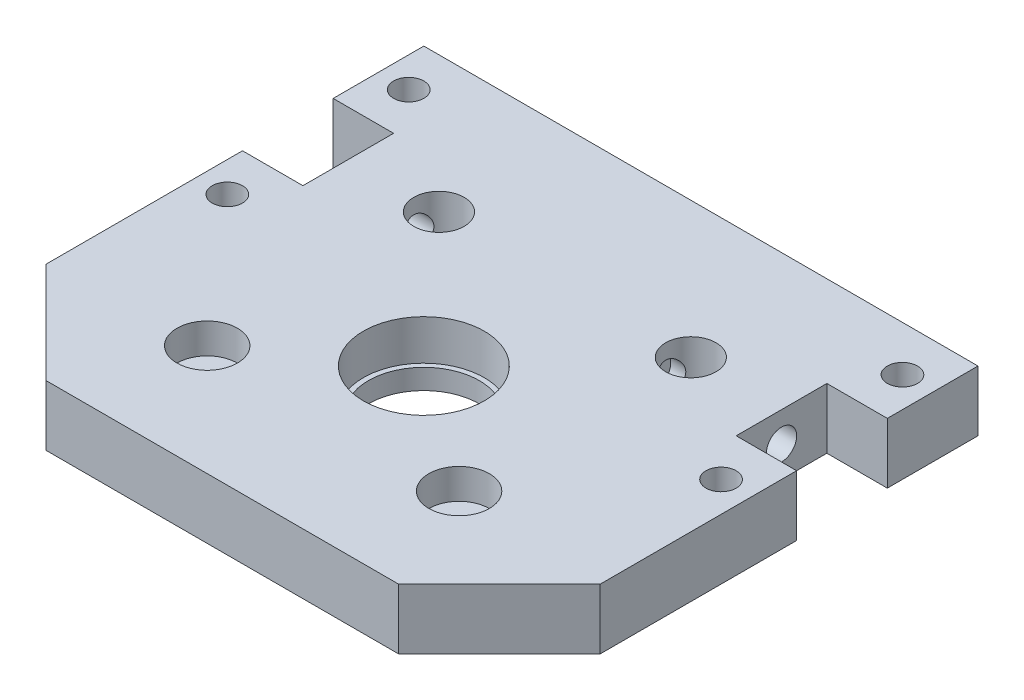
from build123d import *

# Parameters (mm, degrees)
SKETCH1_W           = 66
SKETCH1_H           = 95
SKETCH1_R           = 11
BOSS_EXTRUDE1_DEPTH = 12
BOSS_EXTRUDE3_DEPTH = 12
SKETCH4_R           = 12
CUT_EXTRUDE1_DEPTH  = 8
SKETCH6_R           = 6
CUT_EXTRUDE2_DEPTH  = 6
CHAMFER1_SIZE       = 20
CUT_EXTRUDE3_REACH  = 91.828
SKETCH7_R           = 3
SKETCH7_R_2         = 5
SKETCH9_R           = 3
CUT_EXTRUDE5_DEPTH  = 25


with BuildPart() as part:
    # Sketch1 → Boss-Extrude1 (new body)
    with BuildSketch(Plane(origin=(0, 0, 0), x_dir=(1, 0, 0), z_dir=(0, 1, 0))):
        with Locations((0, -22.5)):
            Rectangle(SKETCH1_W, SKETCH1_H)
        with Locations(Location((0, -30, 0), (0, 0, 270))):
            Circle(SKETCH1_R, mode=Mode.SUBTRACT)
    extrude(amount=BOSS_EXTRUDE1_DEPTH)

    # Sketch3 → Boss-Extrude3 (add)
    with BuildSketch(Plane(origin=(0, 12, 0), x_dir=(1, 0, 0), z_dir=(0, 1, 0))):
        Polygon((55, 7), (43, 7), (43, -11), (55, -11), (55, -70), (33, -70), (33, 25), (55, 25), align=None)
    boss_extrude3 = extrude(amount=-BOSS_EXTRUDE3_DEPTH)

    # Mirror1: Boss-Extrude3 across plane
    add(boss_extrude3.mirror(Plane(origin=(0, 0, 0), x_dir=(0, 0, 1), z_dir=(1, 0, 0))))

    # Sketch4 → Cut-Extrude1 (cut)
    with BuildSketch(Plane(origin=(0, 12, 0), x_dir=(1, 0, 0), z_dir=(0, 1, 0))):
        with Locations(Location((0, -30, 0), (0, 0, 270))):
            Circle(SKETCH4_R)
    extrude(amount=-CUT_EXTRUDE1_DEPTH, mode=Mode.SUBTRACT)

    # Sketch6 → Cut-Extrude2 (cut)
    with BuildSketch(Plane(origin=(0, 12, 0), x_dir=(1, 0, 0), z_dir=(0, 1, 0))):
        with Locations(Location((-25, -48, 0), (0, 0, 270))):
            Circle(SKETCH6_R)
        with Locations(Location((25, -48, 0), (0, 0, 270))):
            Circle(SKETCH6_R)
    extrude(amount=-CUT_EXTRUDE2_DEPTH, mode=Mode.SUBTRACT)

    # Chamfer1
    chamfer1_edges = [part.edges().sort_by_distance(p)[0] for p in [
        (55, 6, 70),
        (-55, 6, 70),
    ]]
    chamfer(chamfer1_edges, length=CHAMFER1_SIZE)

    # Sketch7 → Cut-Extrude3 (cut, up to next)
    with BuildSketch(Plane(origin=(0, 12, 0), x_dir=(1, 0, 0), z_dir=(0, 1, 0)), mode=Mode.PRIVATE) as cut_extrude3_sk1:
        with Locations(Location((-49, 16, 0), (0, 0, 270))):
            Circle(SKETCH7_R)
    cut_extrude3_tool1 = extrude(cut_extrude3_sk1.sketch, amount=-CUT_EXTRUDE3_REACH, mode=Mode.PRIVATE) & part.part
    # Sketch7 → Cut-Extrude3 (cut, up to next)
    with BuildSketch(Plane(origin=(0, 12, 0), x_dir=(1, 0, 0), z_dir=(0, 1, 0)), mode=Mode.PRIVATE) as cut_extrude3_sk2:
        with Locations(Location((-49, -20, 0), (0, 0, 270))):
            Circle(SKETCH7_R)
    cut_extrude3_tool2 = extrude(cut_extrude3_sk2.sketch, amount=-CUT_EXTRUDE3_REACH, mode=Mode.PRIVATE) & part.part
    # Sketch7 → Cut-Extrude3 (cut, up to next)
    with BuildSketch(Plane(origin=(0, 12, 0), x_dir=(1, 0, 0), z_dir=(0, 1, 0)), mode=Mode.PRIVATE) as cut_extrude3_sk3:
        with Locations(Location((-25, -2, 0), (0, 0, 270))):
            Circle(SKETCH7_R_2)
    cut_extrude3_tool3 = extrude(cut_extrude3_sk3.sketch, amount=-CUT_EXTRUDE3_REACH, mode=Mode.PRIVATE) & part.part
    cut_extrude3_1 = cut_extrude3_tool1.solids().sort_by_distance((-49, 12, -16))[0]
    add(cut_extrude3_1, mode=Mode.SUBTRACT)
    cut_extrude3_2 = cut_extrude3_tool2.solids().sort_by_distance((-49, 12, 20))[0]
    add(cut_extrude3_2, mode=Mode.SUBTRACT)
    cut_extrude3_3 = cut_extrude3_tool3.solids().sort_by_distance((-25, 12, 2))[0]
    add(cut_extrude3_3, mode=Mode.SUBTRACT)
    cut_extrude3 = cut_extrude3_1 + cut_extrude3_2 + cut_extrude3_3  # Cut-Extrude3 as one shape, for the pattern or mirror that repeats it

    # Sketch9 → Cut-Extrude5 (cut)
    with BuildSketch(Plane.ZY.offset(43)):
        with Locations((2, 6)):
            Circle(SKETCH9_R)
    cut_extrude5 = extrude(amount=-CUT_EXTRUDE5_DEPTH, mode=Mode.SUBTRACT)

    # Mirror2: Cut-Extrude3, Cut-Extrude5 across plane
    add(cut_extrude3.mirror(Plane(origin=(0, 0, 0), x_dir=(0, 0, 1), z_dir=(1, 0, 0))), mode=Mode.SUBTRACT)
    add(cut_extrude5.mirror(Plane(origin=(0, 0, 0), x_dir=(0, 0, 1), z_dir=(1, 0, 0))), mode=Mode.SUBTRACT)


solid = part.part
